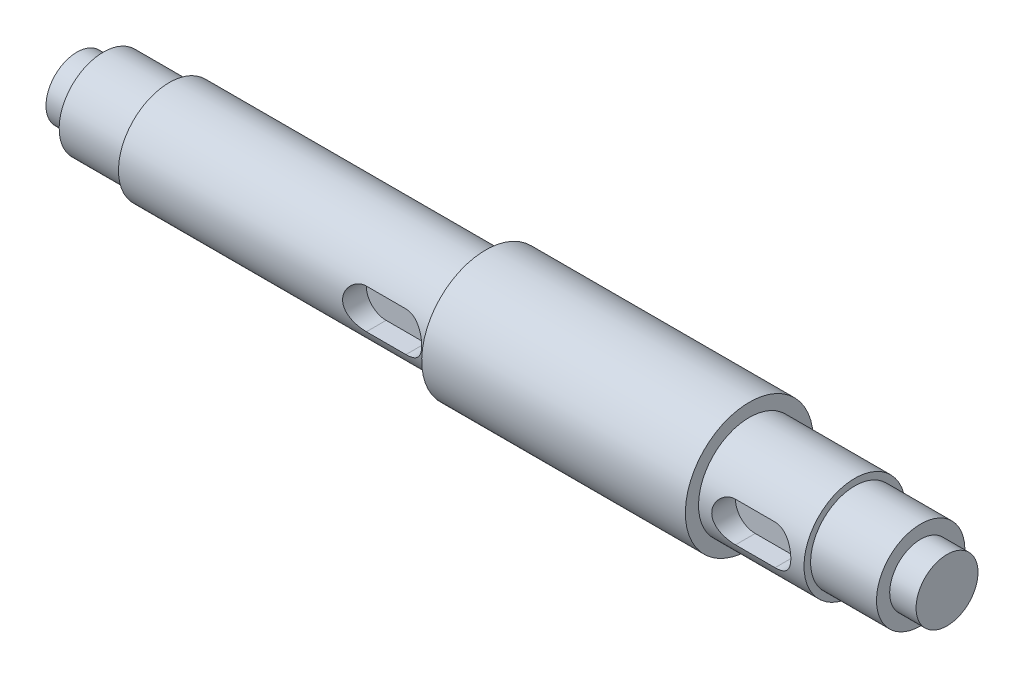
from build123d import *

# Parameters (mm, degrees)
CUT_EXTRUDE_1_DEPTH = 1.8


with BuildPart() as part:
    # 草图1 → 旋转1 (revolve)
    with BuildSketch(Plane.XY, mode=Mode.PRIVATE) as revolve_1_sk:
        Polygon((0, 0), (0, 2.35), (2, 2.35), (2, 3.35), (7, 3.35), (7, 3.85), (31, 3.85), (31, 4.85), (51, 4.85), (51, 3.85), (59, 3.85), (59, 3.35), (64, 3.35), (64, 2.35), (66, 2.35), (66, 0), align=None)
    revolve(revolve_1_sk.sketch.rotate(Axis((0, 0, 0), (1, 0, 0)), 180), axis=Axis((0, 0, 0), (1, 0, 0)))

    # 草图2 → 切除-拉伸1 (cut)
    with BuildSketch(Plane.XY.offset(3.85)):
        with BuildLine():
            Line((25.5, 1.5), (28.5, 1.5))
            ThreePointArc((28.5, 1.5), (30, 0), (28.5, -1.5))
            Line((28.5, -1.5), (25.5, -1.5))
            ThreePointArc((25.5, -1.5), (24, 0), (25.5, 1.5))
        make_face()
        with BuildLine():
            Line((53.5, 1.5), (56.5, 1.5))
            ThreePointArc((56.5, 1.5), (58, 0), (56.5, -1.5))
            Line((56.5, -1.5), (53.5, -1.5))
            ThreePointArc((53.5, -1.5), (52, 0), (53.5, 1.5))
        make_face()
    extrude(amount=-CUT_EXTRUDE_1_DEPTH, mode=Mode.SUBTRACT)


solid = part.part
